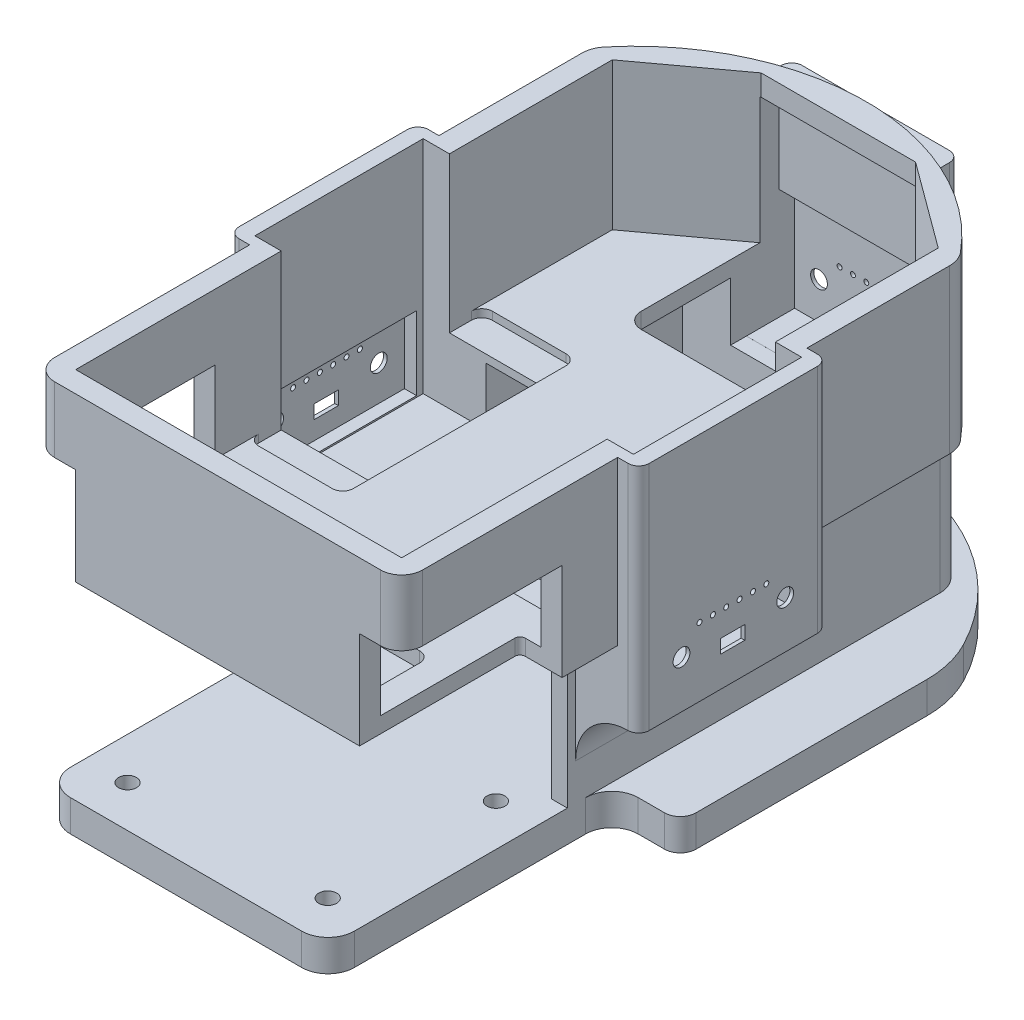
from build123d import *

# Parameters (mm, degrees)
RESSALTO_EXTRUS_O2_DEPTH       = 6
RESSALTO_EXTRUS_O3_DEPTH       = 30
RESSALTO_EXTRUS_O4_DEPTH       = 3
RESSALTO_EXTRUS_O7_DEPTH       = 28
FILETE1_R                      = 20
FILETE2_R                      = 20
ESBO_O22_W                     = 54
ESBO_O22_H                     = 4
RESSALTO_EXTRUS_O8_DEPTH       = 28
ESBO_O24_W                     = 13
ESBO_O24_H                     = 48
CORTE_EXTRUS_O5_DEPTH          = 6
FILETE12_R                     = 5
FILETE13_R                     = 3
FILETE14_R                     = 5
FILETE15_R                     = 3
ESBO_O57_W                     = 41
ESBO_O57_H                     = 41
RESSALTO_EXTRUS_O10_DEPTH      = 2
FILETE23_R                     = 5
RESSALTO_EXTRUS_O11_DEPTH      = 26
RESSALTO_EXTRUS_O11_DEPTH_BACK = 16.09
ESBO_O49_W                     = 32
ESBO_O49_H                     = 7.112738818
ESBO_O59_W                     = 8
ESBO_O59_H                     = 24.5282094
CORTE_EXTRUS_O11_DEPTH         = 3
FILETE27_R                     = 1
FILETE28_R                     = 1
FILETE30_R                     = 5
FILETE31_R                     = 5
RESSALTO_EXTRUS_O13_DEPTH      = 12.5
FILETE36_R                     = 4
FILETE37_R                     = 4
ESBO_O66_R                     = 1.6
ESBO_O66_R_2                   = 0.475
ESBO_O66_W                     = 4.6
ESBO_O66_H                     = 2.6
CORTE_EXTRUS_O15_DEPTH         = 1
CORTE_EXTRUS_O17_START         = -19.13
ESBO_O64_W                     = 29.510166656
ESBO_O64_H                     = 38.090092776
CORTE_EXTRUS_O17_DEPTH         = 15.5
FILETE49_R                     = 2
FILETE52_R                     = 2
ESBO_O73_W                     = 54
ESBO_O73_H                     = 6
RESSALTO_EXTRUS_O14_DEPTH      = 6
FILETE60_R                     = 5
FILETE61_R                     = 5
ESBO_O77_R                     = 1.7
CORTE_EXTRUS_O25_DEPTH         = 6
ESBO_O78_W                     = 36
ESBO_O78_H                     = 44
RESSALTO_EXTRUS_O16_DEPTH      = 4
RESSALTO_EXTRUS_O17_START      = -4
ESBO_O81_W                     = 36
ESBO_O81_H                     = 13
RESSALTO_EXTRUS_O17_DEPTH      = 8
ESBO_O62_W                     = 29.49276957
ESBO_O62_H                     = 14
CORTE_EXTRUS_O29_DEPTH         = 3.3
ESBO_O63_R                     = 1.6
ESBO_O63_R_2                   = 0.475
ESBO_O63_W                     = 4.6
ESBO_O63_H                     = 2.6
CORTE_EXTRUS_O30_DEPTH         = 4
ESBO_O83_W                     = 23
ESBO_O83_H                     = 32
CORTE_EXTRUS_O31_DEPTH         = 42
RESSALTO_EXTRUS_O18_START      = -4
ESBO_O92_W                     = 36
ESBO_O92_H                     = 13
RESSALTO_EXTRUS_O18_DEPTH      = 8
FILETE67_R                     = 2
FILETE68_R                     = 2
ESBO_O96_W                     = 44.09452927
ESBO_O96_H                     = 13.12
CORTE_EXTRUS_O34_DEPTH         = 3
ESBO_O98_W                     = 29.510166656
ESBO_O98_H                     = 12
CORTE_EXTRUS_O37_DEPTH         = 28
FILETE69_R                     = 10
FILETE70_R                     = 10
FILETE77_R                     = 2
ESBO_O107_W                    = 18
ESBO_O107_H                    = 6.281806531
ESBO_O107_H_2                  = 6.157121046
CORTE_EXTRUS_O45_DEPTH         = 1.5
FILETE83_R                     = 2
CORTE_EXTRUS_O46_DEPTH         = 28
ESBO_O115_W                    = 32
ESBO_O115_H                    = 13.09
RESSALTO_EXTRUS_O20_DEPTH      = 2.68
CORTE_EXTRUS_O47_DEPTH         = 4
ESBO_O119_W                    = 29.510166656
ESBO_O119_H                    = 2.68
CORTE_EXTRUS_O48_DEPTH         = 11.09
ESBO_O120_W                    = 29.510166656
ESBO_O120_H                    = 14
CORTE_EXTRUS_O49_DEPTH         = 3
ESBO_O121_W                    = 29.510166656
ESBO_O121_H                    = 7.110033959
CORTE_EXTRUS_O50_DEPTH         = 3
CORTE_EXTRUS_O51_DEPTH         = 3
FILETE88_R                     = 3
FILETE89_R                     = 3


with BuildPart() as part:
    # Esboço4 → Ressalto-extrusão2 (new body)
    with BuildSketch(Plane(origin=(0, 0, 0), x_dir=(1, 0, 0), z_dir=(0, 1, 0))):
        with BuildLine():
            Line((-55, -98.867635759), (25, -98.867635759))
            Line((25, -98.867635759), (25, 0.132364241))
            ThreePointArc((25, 0.132364241), (-15, 28.132364241), (-55, 0.132364241))
            Line((-55, 0.132364241), (-55, -98.867635759))
        make_face()
    extrude(amount=-RESSALTO_EXTRUS_O2_DEPTH)

    # Esboço5 → Ressalto-extrusão3 (add)
    with BuildSketch(Plane(origin=(0, 0, 0), x_dir=(1, 0, 0), z_dir=(0, 1, 0))):
        Polygon((9, -59.337635759), (12, -59.337635759), (12, 16.532364241), (-42, 16.532364241), (-42, -59.337635759), (-39, -59.337635759), (-39, 13.532364241), (9, 13.532364241), align=None)
    extrude(amount=RESSALTO_EXTRUS_O3_DEPTH)

    # Filete1
    filete1_edges = [part.edges().sort_by_distance(p)[0] for p in [
        (-55, -3, -0.132364241),
    ]]
    fillet(filete1_edges, radius=FILETE1_R)

    # Filete2
    filete2_edges = [part.edges().sort_by_distance(p)[0] for p in [
        (25, -3, -0.132364241),
    ]]
    fillet(filete2_edges, radius=FILETE2_R)

    # Esboço24 → Corte-extrusão5 (cut)
    with BuildSketch(Plane(origin=(0, 0, 0), x_dir=(1, 0, 0), z_dir=(0, 1, 0))):
        with Locations((-48.5, -74.867635759)):
            Rectangle(ESBO_O24_W, ESBO_O24_H)
        with Locations((18.5, -74.867635759)):
            Rectangle(ESBO_O24_W, ESBO_O24_H)
    extrude(amount=-CORTE_EXTRUS_O5_DEPTH, mode=Mode.SUBTRACT)

    # Filete12
    filete12_edges = [part.edges().sort_by_distance(p)[0] for p in [
        (-42, -3, 50.867635759),
    ]]
    fillet(filete12_edges, radius=FILETE12_R)

    # Filete13
    filete13_edges = [part.edges().sort_by_distance(p)[0] for p in [
        (-55, -3, 50.867635759),
    ]]
    fillet(filete13_edges, radius=FILETE13_R)

    # Filete14
    filete14_edges = [part.edges().sort_by_distance(p)[0] for p in [
        (12, -3, 50.867635759),
    ]]
    fillet(filete14_edges, radius=FILETE14_R)

    # Filete15
    filete15_edges = [part.edges().sort_by_distance(p)[0] for p in [
        (25, -3, 50.867635759),
    ]]
    fillet(filete15_edges, radius=FILETE15_R)

    # Esboço57 → Ressalto-extrusão10 (add)
    with BuildSketch(Plane(origin=(0, -6, 0), x_dir=(-1, 0, 0), z_dir=(0, -1, 0))):
        with Locations((15, -14.367635759)):
            Rectangle(ESBO_O57_W, ESBO_O57_H)
    extrude(amount=RESSALTO_EXTRUS_O10_DEPTH)

    # Filete23
    filete23_edges = [part.edges().sort_by_distance(p)[0] for p in [
        (12, 15, -16.532364241),
        (-42, 15, -16.532364241),
    ]]
    fillet(filete23_edges, radius=FILETE23_R)

    # Esboço73 → Ressalto-extrusão14 (add)
    with BuildSketch(Plane.XY.offset(98.867635759)):
        with Locations((-15, -3)):
            Rectangle(ESBO_O73_W, ESBO_O73_H)
    extrude(amount=RESSALTO_EXTRUS_O14_DEPTH)

    # Filete60
    filete60_edges = [part.edges().sort_by_distance(p)[0] for p in [
        (12, -3, 104.867635759),
    ]]
    fillet(filete60_edges, radius=FILETE60_R)

    # Filete61
    filete61_edges = [part.edges().sort_by_distance(p)[0] for p in [
        (-42, -3, 104.867635759),
    ]]
    fillet(filete61_edges, radius=FILETE61_R)

    # Esboço77 → Corte-extrusão25 (cut)
    with BuildSketch(Plane(origin=(0, -6, 0), x_dir=(-1, 0, 0), z_dir=(0, -1, 0))):
        with Locations(Location((-4.04, -96.967635759, 0), (0, 0, 90))):
            Circle(ESBO_O77_R)
        with Locations(Location((-4.04, -64.967635759, 0), (0, 0, 90))):
            Circle(ESBO_O77_R)
        with Locations(Location((34.04, -64.967635759, 0), (0, 0, 270))):
            Circle(ESBO_O77_R)
        with Locations(Location((34.04, -96.967635759, 0), (0, 0, 270))):
            Circle(ESBO_O77_R)
    extrude(amount=-CORTE_EXTRUS_O25_DEPTH, mode=Mode.SUBTRACT)


with BuildPart() as body_2:
    # Esboço11 → Ressalto-extrusão4 (new body)
    with BuildSketch(Plane(origin=(0, 30, 0), x_dir=(1, 0, 0), z_dir=(0, 1, 0))):
        with BuildLine():
            Line((-42, -92.867635759), (-42, -98.867635759))
            Line((-42, -98.867635759), (12, -98.867635759))
            Line((12, -98.867635759), (12, -92.867635759))
            Line((12, -92.867635759), (20, -92.867635759))
            Line((20, -92.867635759), (20, 7.132364241))
            ThreePointArc((20, 7.132364241), (-15, 24.470975936), (-50, 7.132364241))
            Line((-50, 7.132364241), (-50, -92.867635759))
            Line((-50, -92.867635759), (-42, -92.867635759))
        make_face()
    extrude(amount=RESSALTO_EXTRUS_O4_DEPTH)

    # Esboço15 → Ressalto-extrusão7 (add)
    with BuildSketch(Plane(origin=(0, 33, 0), x_dir=(1, 0, 0), z_dir=(0, 1, 0))):
        with BuildLine():
            Line((-46, 7.199765875), (-46, -68.339426359))
            Line((-46, -68.339426359), (-50, -68.339426359))
            Line((-50, -68.339426359), (-50, 7.132364241))
            ThreePointArc((-50, 7.132364241), (-15, 24.470975936), (20, 7.132364241))
            Line((20, 7.132364241), (20, -68.339426359))
            Line((20, -68.339426359), (16, -68.339426359))
            Line((16, -68.339426359), (16, 7.199765875))
            Line((16, 7.199765875), (-46, 7.199765875))
        make_face()
    extrude(amount=RESSALTO_EXTRUS_O7_DEPTH)

    # Esboço49 → Ressalto-extrusão11 (add, two sides: drawn at the far end of the back side and taken through both)
    with BuildSketch(Plane(origin=(0, 33, 0), x_dir=(1, 0, 0), z_dir=(0, 1, 0)).offset(-RESSALTO_EXTRUS_O11_DEPTH_BACK)):
        with Locations((-15, 22.773396466)):
            Rectangle(ESBO_O49_W, ESBO_O49_H)
    extrude(amount=RESSALTO_EXTRUS_O11_DEPTH + RESSALTO_EXTRUS_O11_DEPTH_BACK)

    # Esboço59 → Corte-extrusão11 (cut)
    with BuildSketch(Plane(origin=(0, 33, 0), x_dir=(1, 0, 0), z_dir=(0, 1, 0))):
        with Locations((-46, -80.603531059)):
            Rectangle(ESBO_O59_W, ESBO_O59_H)
        with Locations((16, -80.603531059)):
            Rectangle(ESBO_O59_W, ESBO_O59_H)
    extrude(amount=-CORTE_EXTRUS_O11_DEPTH, mode=Mode.SUBTRACT)

    # Filete27
    filete27_edges = [body_2.edges().sort_by_distance(p)[0] for p in [
        (12, 31.5, 68.339426359),
    ]]
    fillet(filete27_edges, radius=FILETE27_R)

    # Filete28
    filete28_edges = [body_2.edges().sort_by_distance(p)[0] for p in [
        (-42, 31.5, 68.339426359),
    ]]
    fillet(filete28_edges, radius=FILETE28_R)

    # Filete30
    filete30_edges = [body_2.edges().sort_by_distance(p)[0] for p in [
        (20, 45.5, -7.132364241),
    ]]
    fillet(filete30_edges, radius=FILETE30_R)

    # Filete31
    filete31_edges = [body_2.edges().sort_by_distance(p)[0] for p in [
        (-50, 45.5, -7.132364241),
    ]]
    fillet(filete31_edges, radius=FILETE31_R)



with BuildPart() as body_3:
    # Esboço22 → Ressalto-extrusão8 (new body)
    with BuildSketch(Plane(origin=(0, 33, 0), x_dir=(1, 0, 0), z_dir=(0, 1, 0))):
        with Locations((-15, -96.867635759)):
            Rectangle(ESBO_O22_W, ESBO_O22_H)
    extrude(amount=RESSALTO_EXTRUS_O8_DEPTH)


with BuildPart() as body_2_1:
    add(body_2.part)

    add(body_3.part)  # Ressalto-extrusão13 merges body 3
    # Esboço61 → Ressalto-extrusão13 (add)
    with BuildSketch(Plane(origin=(0, 61, 0), x_dir=(1, 0, 0), z_dir=(0, 1, 0))):
        Polygon((20, -68.339426359), (20, -98.867635759), (12, -98.867635759), (12, -94.867635759), (16, -94.867635759), (16, -68.339426359), align=None)
        Polygon((-46, -68.339426359), (-46, -94.867635759), (-42, -94.867635759), (-42, -98.867635759), (-50, -98.867635759), (-50, -68.339426359), align=None)
    extrude(amount=-RESSALTO_EXTRUS_O13_DEPTH)

    # Filete36
    filete36_edges = [body_2_1.edges().sort_by_distance(p)[0] for p in [
        (20, 54.75, 98.867635759),
    ]]
    fillet(filete36_edges, radius=FILETE36_R)

    # Filete37
    filete37_edges = [body_2_1.edges().sort_by_distance(p)[0] for p in [
        (-50, 54.75, 98.867635759),
    ]]
    fillet(filete37_edges, radius=FILETE37_R)

    # Esboço66 → Corte-extrusão15 (cut)
    with BuildSketch(Plane(origin=(0, 0, -26.329765875), x_dir=(-1, 0, 0), z_dir=(0, 0, -1))):
        with Locations((4.82223254, 25.986292756)):
            Circle(ESBO_O66_R)
        with Locations((8.570002153, 30.020093406)):
            Circle(ESBO_O66_R_2)
        with Locations(Location((25.17776746, 25.986292756, 0), (0, 0, 180))):
            Circle(ESBO_O66_R)
        with Locations((11.110002153, 30.020093406)):
            Circle(ESBO_O66_R_2)
        with Locations((13.650002153, 30.020093406)):
            Circle(ESBO_O66_R_2)
        with Locations((16.190002153, 30.020093406)):
            Circle(ESBO_O66_R_2)
        with Locations((18.730002153, 30.020093406)):
            Circle(ESBO_O66_R_2)
        with Locations((21.270002153, 30.020093406)):
            Circle(ESBO_O66_R_2)
        with Locations((14.878521563, 24.080061816)):
            Rectangle(ESBO_O66_W, ESBO_O66_H)
    extrude(amount=-CORTE_EXTRUS_O15_DEPTH, mode=Mode.SUBTRACT)

    # Esboço64 → Corte-extrusão17 (cut)
    with BuildSketch(Plane(origin=(0, 0, -26.329765875), x_dir=(-1, 0, 0), z_dir=(0, 0, -1)).offset(CORTE_EXTRUS_O17_START)):
        with Locations((15.070083328, 37.955046388)):
            Rectangle(ESBO_O64_W, ESBO_O64_H)
    extrude(amount=CORTE_EXTRUS_O17_DEPTH, mode=Mode.SUBTRACT)

    # Filete49
    filete49_edges = [body_2_1.edges().sort_by_distance(p)[0] for p in [
        (1, 37.955, -26.329765875),
    ]]
    fillet(filete49_edges, radius=FILETE49_R)

    # Filete52
    filete52_edges = [body_2_1.edges().sort_by_distance(p)[0] for p in [
        (-31, 37.955, -26.329765875),
    ]]
    fillet(filete52_edges, radius=FILETE52_R)


    add(part.part)  # Ressalto-extrusão16 merges part
    # Esboço78 → Ressalto-extrusão16 (add)
    with BuildSketch(Plane(origin=(20, 0, 0), x_dir=(0, 0, -1), z_dir=(1, 0, 0))):
        with Locations((-39.775813297, 39)):
            Rectangle(ESBO_O78_W, ESBO_O78_H)
    ressalto_extrus_o16 = extrude(amount=RESSALTO_EXTRUS_O16_DEPTH)

    # Esboço81 → Ressalto-extrusão17 (add)
    with BuildSketch(Plane(origin=(24, 0, 0), x_dir=(0, 0, -1), z_dir=(1, 0, 0)).offset(RESSALTO_EXTRUS_O17_START)):
        with Locations((-39.775813297, 23.5)):
            Rectangle(ESBO_O81_W, ESBO_O81_H)
    extrude(amount=-RESSALTO_EXTRUS_O17_DEPTH)

    # Esboço62 → Corte-extrusão29 (cut)
    with BuildSketch(Plane(origin=(20, 0, 0), x_dir=(0, 0, -1), z_dir=(1, 0, 0))):
        with Locations((-39.774428574, 26.29172499)):
            Rectangle(ESBO_O62_W, ESBO_O62_H)
    corte_extrus_o29 = extrude(amount=CORTE_EXTRUS_O29_DEPTH, mode=Mode.SUBTRACT)

    # Esboço63 → Corte-extrusão30 (cut)
    with BuildSketch(Plane(origin=(20, 0, 0), x_dir=(0, 0, -1), z_dir=(1, 0, 0))):
        with Locations(Location((-49.63398598, 25.987922534, 0), (0, 0, 180))):
            Circle(ESBO_O63_R)
        with Locations(Location((-29.914871168, 25.987922534, 0), (0, 0, 180))):
            Circle(ESBO_O63_R)
        with Locations(Location((-46.204426421, 30.021723186, 0), (0, 0, 180))):
            Circle(ESBO_O63_R_2)
        with Locations(Location((-43.664426421, 30.021723186, 0), (0, 0, 180))):
            Circle(ESBO_O63_R_2)
        with Locations(Location((-41.124426421, 30.021723186, 0), (0, 0, 180))):
            Circle(ESBO_O63_R_2)
        with Locations(Location((-38.584426421, 30.021723186, 0), (0, 0, 180))):
            Circle(ESBO_O63_R_2)
        with Locations(Location((-36.044426421, 30.021723186, 0), (0, 0, 180))):
            Circle(ESBO_O63_R_2)
        with Locations(Location((-33.504426421, 30.021723186, 0), (0, 0, 180))):
            Circle(ESBO_O63_R_2)
        with Locations((-39.895907011, 24.081692226)):
            Rectangle(ESBO_O63_W, ESBO_O63_H)
    corte_extrus_o30 = extrude(amount=CORTE_EXTRUS_O30_DEPTH, mode=Mode.SUBTRACT)

    # Esboço83 → Corte-extrusão31 (cut)
    with BuildSketch(Plane(origin=(0, 61, 0), x_dir=(1, 0, 0), z_dir=(0, 1, 0))):
        with Locations((9.5, -39.775813297)):
            Rectangle(ESBO_O83_W, ESBO_O83_H)
    corte_extrus_o31 = extrude(amount=-CORTE_EXTRUS_O31_DEPTH, mode=Mode.SUBTRACT)

    # Espelhar7: Ressalto-extrusão16 across plane
    add(ressalto_extrus_o16.mirror(Plane.ZY.offset(15)))

    # Esboço92 → Ressalto-extrusão18 (add)
    with BuildSketch(Plane.ZY.offset(54).offset(RESSALTO_EXTRUS_O18_START)):
        with Locations((39.775813297, 23.5)):
            Rectangle(ESBO_O92_W, ESBO_O92_H)
    extrude(amount=-RESSALTO_EXTRUS_O18_DEPTH)

    # Espelhar21: Corte-extrusão29, Corte-extrusão30, Corte-extrusão31 across plane
    add(corte_extrus_o29.mirror(Plane.ZY.offset(15)), mode=Mode.SUBTRACT)
    add(corte_extrus_o30.mirror(Plane.ZY.offset(15)), mode=Mode.SUBTRACT)
    add(corte_extrus_o31.mirror(Plane.ZY.offset(15)), mode=Mode.SUBTRACT)

    # Filete67
    filete67_edges = [body_2_1.edges().sort_by_distance(p)[0] for p in [
        (24, 39, 57.775813297),
        (24, 39, 21.775813297),
    ]]
    fillet(filete67_edges, radius=FILETE67_R)

    # Filete68
    filete68_edges = [body_2_1.edges().sort_by_distance(p)[0] for p in [
        (-54, 39, 57.775813297),
        (-54, 39, 21.775813297),
    ]]
    fillet(filete68_edges, radius=FILETE68_R)

    # Esboço96 → Corte-extrusão34 (cut)
    with BuildSketch(Plane(origin=(0, 33, 0), x_dir=(1, 0, 0), z_dir=(0, 1, 0))):
        with Locations((-15, -87.037635759)):
            Rectangle(ESBO_O96_W, ESBO_O96_H)
    extrude(amount=-CORTE_EXTRUS_O34_DEPTH, mode=Mode.SUBTRACT)

    # Esboço98 → Corte-extrusão37 (cut)
    with BuildSketch(Plane(origin=(0, 18.91, 0), x_dir=(1, 0, 0), z_dir=(0, 1, 0))):
        with Locations((-15.070083328, 13.199765875)):
            Rectangle(ESBO_O98_W, ESBO_O98_H)
    extrude(amount=CORTE_EXTRUS_O37_DEPTH, mode=Mode.SUBTRACT)

    # Filete69
    filete69_edges = [body_2_1.edges().sort_by_distance(p)[0] for p in [
        (12, 17, 39.775813297),
    ]]
    fillet(filete69_edges, radius=FILETE69_R)

    # Filete70
    filete70_edges = [body_2_1.edges().sort_by_distance(p)[0] for p in [
        (-42, 17, 39.775813297),
    ]]
    fillet(filete70_edges, radius=FILETE70_R)

    # Filete77
    filete77_edges = [body_2_1.edges().sort_by_distance(p)[0] for p in [
        (-37.047264635, 31.5, 93.597635759),
        (-37.047264635, 31.5, 80.477635759),
        (7.047264635, 31.5, 80.477635759),
        (7.047264635, 31.5, 93.597635759),
    ]]
    fillet(filete77_edges, radius=FILETE77_R)

    # Esboço107 → Corte-extrusão45 (cut)
    with BuildSketch(Plane(origin=(0, 33, 0), x_dir=(1, 0, 0), z_dir=(0, 1, 0))):
        with Locations((7, -58.916716563)):
            Rectangle(ESBO_O107_W, ESBO_O107_H)
        with Locations((7, -20.697252774)):
            Rectangle(ESBO_O107_W, ESBO_O107_H_2)
        with Locations((-37, -58.916716563)):
            Rectangle(ESBO_O107_W, ESBO_O107_H)
        with Locations((-37, -20.697252774)):
            Rectangle(ESBO_O107_W, ESBO_O107_H_2)
    extrude(amount=-CORTE_EXTRUS_O45_DEPTH, mode=Mode.SUBTRACT)

    # Filete83
    filete83_edges = [body_2_1.edges().sort_by_distance(p)[0] for p in [
        (-2, 32.25, 17.618692251),
        (16, 32.25, 17.618692251),
        (-28, 32.25, 62.057619828),
        (-46, 32.25, 62.057619828),
        (-46, 32.25, 17.618692251),
        (-28, 32.25, 17.618692251),
        (16, 32.25, 62.057619828),
        (-2, 32.25, 62.057619828),
    ]]
    fillet(filete83_edges, radius=FILETE83_R)

    # Esboço113 → Corte-extrusão46 (cut)
    with BuildSketch(Plane(origin=(0, 61, 0), x_dir=(1, 0, 0), z_dir=(0, 1, 0))):
        Polygon((-0.315, 19.199765875), (16, 7.199765875), (-0.315, 7.199765875), align=None)
        Polygon((-46, 7.199765875), (-29.685, 7.199765875), (-29.685, 19.199765875), align=None)
    extrude(amount=-CORTE_EXTRUS_O46_DEPTH, mode=Mode.SUBTRACT)

    # Esboço115 → Ressalto-extrusão20 (add)
    with BuildSketch(Plane.XY.offset(-19.217027057)):
        with Locations((-15, 23.455)):
            Rectangle(ESBO_O115_W, ESBO_O115_H)
    extrude(amount=RESSALTO_EXTRUS_O20_DEPTH)

    # Esboço116 → Corte-extrusão47 (cut)
    with BuildSketch(Plane(origin=(0, 61, 0), x_dir=(1, 0, 0), z_dir=(0, 1, 0))):
        Polygon((-29.685, 19.199765875), (-0.315, 19.199765875), (-0.315, 7.199765875), (-29.825166656, 7.199765875), align=None)
    extrude(amount=-CORTE_EXTRUS_O47_DEPTH, mode=Mode.SUBTRACT)

    # Esboço119 → Corte-extrusão48 (cut)
    with BuildSketch(Plane(origin=(0, 30, 0), x_dir=(1, 0, 0), z_dir=(0, 1, 0))):
        with Locations((-15.070083328, 17.877027057)):
            Rectangle(ESBO_O119_W, ESBO_O119_H)
    extrude(amount=-CORTE_EXTRUS_O48_DEPTH, mode=Mode.SUBTRACT)

    # Esboço120 → Corte-extrusão49 (cut)
    with BuildSketch(Plane.XY.offset(-22.699765875)):
        with Locations((-15.070083328, 25.91)):
            Rectangle(ESBO_O120_W, ESBO_O120_H)
    extrude(amount=-CORTE_EXTRUS_O49_DEPTH, mode=Mode.SUBTRACT)

    # Esboço121 → Corte-extrusão50 (cut)
    with BuildSketch(Plane.XY.offset(-22.699765875)):
        with Locations((-15.070083328, 36.46501698)):
            Rectangle(ESBO_O121_W, ESBO_O121_H)
    extrude(amount=-CORTE_EXTRUS_O50_DEPTH, mode=Mode.SUBTRACT)

    # Esboço122 → Corte-extrusão51 (cut)
    with BuildSketch(Plane(origin=(0, 33, 0), x_dir=(1, 0, 0), z_dir=(0, 1, 0))):
        Polygon((-29.825166656, 13.532364241), (-29.825166656, -6.467635759), (0, -6.467635759), (-0.315, 13.199765875), align=None)
    extrude(amount=-CORTE_EXTRUS_O51_DEPTH, mode=Mode.SUBTRACT)

    # Filete88
    filete88_edges = [body_2_1.edges().sort_by_distance(p)[0] for p in [
        (0, 31.5, 6.467635759),
        (-29.825166656, 31.5, 6.467635759),
    ]]
    fillet(filete88_edges, radius=FILETE88_R)

    # Filete89
    filete89_edges = [body_2_1.edges().sort_by_distance(p)[0] for p in [
        (-15.070083328, 57.000092776, -22.699765875),
    ]]
    fillet(filete89_edges, radius=FILETE89_R)


solid = body_2_1.part
